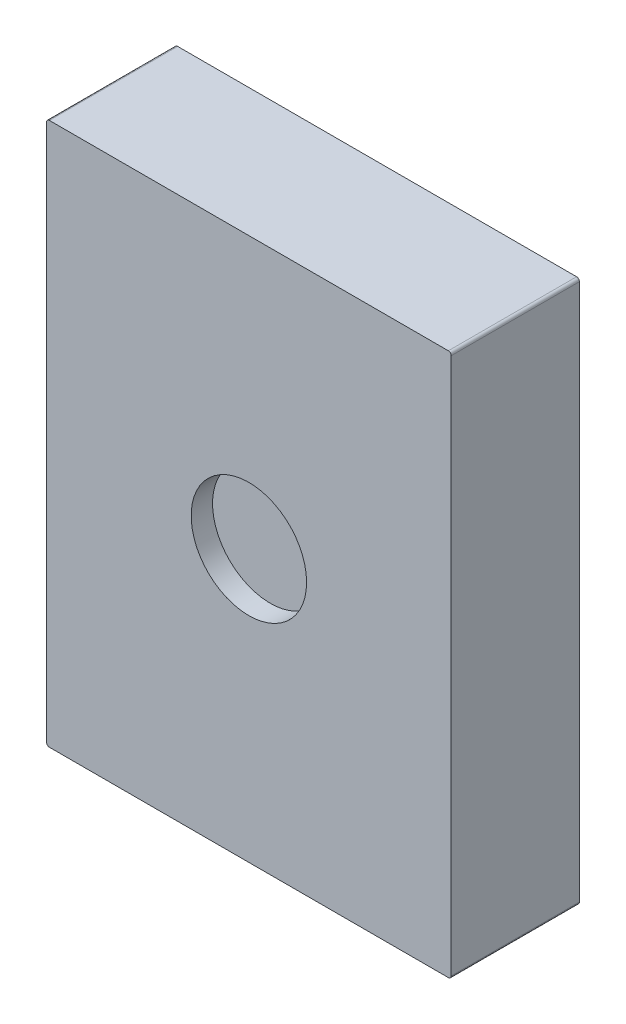
from build123d import *

# Parameters (mm, degrees)
SKETCH1_W           = 284
SKETCH1_H           = 381
BOSS_EXTRUDE1_DEPTH = 60
SKETCH3_W           = 284
SKETCH3_H           = 381
BOSS_EXTRUDE2_DEPTH = 30
SKETCH4_R           = 40.5
CUT_EXTRUDE1_DEPTH  = 15
SHELL1_T            = -10
FILLET1_R           = 2


with BuildPart() as part:
    # Sketch1 → Boss-Extrude1 (new body)
    with BuildSketch(Plane.XY):
        Rectangle(SKETCH1_W, SKETCH1_H)
    extrude(amount=BOSS_EXTRUDE1_DEPTH)

    # Sketch3 → Boss-Extrude2 (add)
    with BuildSketch(Plane.XY.offset(60)):
        Rectangle(SKETCH3_W, SKETCH3_H)
    extrude(amount=BOSS_EXTRUDE2_DEPTH)

    # Sketch4 → Cut-Extrude1 (cut)
    with BuildSketch(Plane.XY.offset(90)):
        Circle(SKETCH4_R)
    extrude(amount=-CUT_EXTRUDE1_DEPTH, mode=Mode.SUBTRACT)

    # Shell1
    shell1_openings = [part.faces().sort_by_distance(p)[0] for p in [
        (0, -190.5, 45),
    ]]
    offset(amount=SHELL1_T, openings=shell1_openings, kind=Kind.INTERSECTION)

    # Fillet1
    fillet1_edges = [part.edges().sort_by_distance(p)[0] for p in [
        (142, -190.5, 45),
        (-142, -190.5, 45),
        (-142, 190.5, 45),
        (142, 190.5, 45),
    ]]
    fillet(fillet1_edges, radius=FILLET1_R)


solid = part.part
